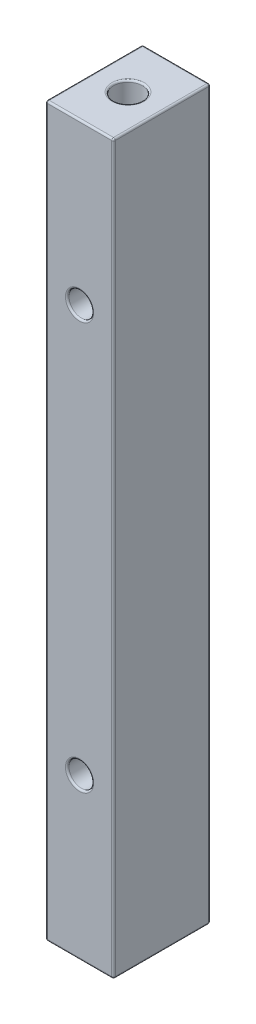
from build123d import *

# Parameters (mm, degrees)
SKETCH1_W                = 9.525
SKETCH1_H                = 13.59916
SKETCH1_R                = 2.0193
BOSS_EXTRUDE1_DEPTH      = 51.054
BOSS_EXTRUDE2_DEPTH      = 38.354
BOSS_EXTRUDE2_DEPTH_BACK = 38.354
SKETCH2_R                = 2.0193
SKETCH4_R                = 1.7272
CUT_EXTRUDE1_DEPTH       = 13.59916
FILLET2_R                = 0.254


with BuildPart() as part:
    # Sketch1 → Boss-Extrude1 (new, symmetric)
    with BuildSketch(Plane(origin=(0, 0, 0), x_dir=(1, 0, 0), z_dir=(0, 1, 0))):
        Rectangle(SKETCH1_W, SKETCH1_H)
        with Locations(Location((0, 0, 0), (0, 0, 270))):
            Circle(SKETCH1_R, mode=Mode.SUBTRACT)
    extrude(amount=BOSS_EXTRUDE1_DEPTH, both=True)

    # Sketch2 → Boss-Extrude2 (add, two sides: drawn at the far end of the back side and taken through both)
    with BuildSketch(Plane(origin=(0, 0, 0), x_dir=(1, 0, 0), z_dir=(0, 1, 0)).offset(-BOSS_EXTRUDE2_DEPTH_BACK)):
        with Locations(Location((0, 0, 0), (0, 0, 270))):
            Circle(SKETCH2_R)
    extrude(amount=BOSS_EXTRUDE2_DEPTH + BOSS_EXTRUDE2_DEPTH_BACK)

    # Sketch4 → Cut-Extrude1 (cut)
    with BuildSketch(Plane(origin=(0, 0, -6.79958), x_dir=(-1, 0, 0), z_dir=(0, 0, -1))):
        with Locations((0, 28.575)):
            Circle(SKETCH4_R)
        with Locations((0, -28.575)):
            Circle(SKETCH4_R)
    extrude(amount=-CUT_EXTRUDE1_DEPTH, mode=Mode.SUBTRACT)

    # Fillet2
    fillet2_edges = [part.edges().sort_by_distance(p)[0] for p in [
        (-4.7625, 51.054, 0),
        (0, -51.054, -2.0193),
        (0, 51.054, -2.0193),
        (0, 51.054, 6.79958),
        (1.7272, 28.575, -6.79958),
        (1.7272, 28.575, 6.79958),
        (1.7272, -28.575, -6.79958),
        (1.7272, -28.575, 6.79958),
        (4.7625, 51.054, 0),
        (0, -51.054, 6.79958),
        (-4.7625, -51.054, 0),
        (0, -51.054, -6.79958),
        (4.7625, -51.054, 0),
        (0, 51.054, -6.79958),
        (4.7625, 0, 6.79958),
        (-4.7625, 0, 6.79958),
        (-4.7625, 0, -6.79958),
        (4.7625, 0, -6.79958),
    ]]
    fillet(fillet2_edges, radius=FILLET2_R)


solid = part.part
